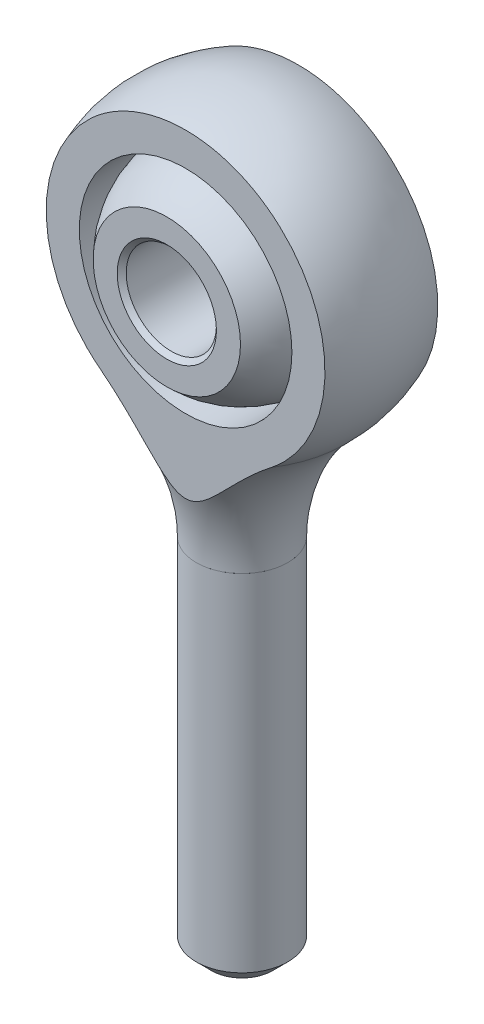
from build123d import *

# Parameters (mm, degrees)
SKETCH14_W               = 2.413
SKETCH14_H               = 19.05
CUT_EXTRUDE10_DEPTH      = 24.492854632
CUT_EXTRUDE10_DEPTH_BACK = 24.492854632
CUT_EXTRUDE9_DEPTH       = 23.310765057
CUT_EXTRUDE9_DEPTH_BACK  = 23.310765057
SKETCH17_R               = 5.6118125
CUT_EXTRUDE4_DEPTH       = 23.798733003
CUT_EXTRUDE4_DEPTH_BACK  = 23.798733003
SKETCH10_R               = 2.38125
CUT_EXTRUDE7_START       = -3.96875
SKETCH22_W               = 15.875
SKETCH22_H               = 20.6375
CUT_EXTRUDE7_DEPTH       = 19.829983003
CUT_EXTRUDE8_START       = 3.96875
SKETCH23_W               = 15.875
SKETCH23_H               = 20.6375
CUT_EXTRUDE8_DEPTH       = 19.829983003
CHAMFER1_SIZE            = 0.79502
CHAMFER2_SIZE            = 0.238125


with BuildPart() as part:
    # Sketch14 → Revolve4 (revolve)
    with BuildSketch(Plane.XY, mode=Mode.PRIVATE) as revolve4_sk:
        with Locations((1.2065, -9.525)):
            Rectangle(SKETCH14_W, SKETCH14_H)
    revolve(revolve4_sk.sketch.rotate(Axis((0, 0, 0), (0, -1, 0)), 180), axis=Axis((0, 0, 0), (0, -1, 0)))

    # Chamfer1
    chamfer1_edges = [part.edges().sort_by_distance(p)[0] for p in [
        (2.413, -19.05, 0),
    ]]
    chamfer(chamfer1_edges, length=CHAMFER1_SIZE)


with BuildPart() as body_2:
    # Sketch21 → Revolve5 (revolve)
    with BuildSketch(Plane.XY):
        with BuildLine():
            Line((0, 20.6375), (0, 0))
            Line((0, 0), (2.413, 0))
            ThreePointArc((2.413, 0), (3.195090321, 3.75855696), (5.41152983, 6.893172024))
            ThreePointArc((5.41152983, 6.893172024), (7.385648357, 15.607938203), (0, 20.6375))
        make_face()
    revolve(axis=Axis((0, 0, 0), (0, -1, 0)))

    # Sketch24 → Cut-Extrude10 (cut, two sides: drawn at the far end of the back side and taken through both)
    with BuildSketch(Plane(origin=(0, 0, 0), x_dir=(0, 0, -1), z_dir=(1, 0, 0)).offset(-CUT_EXTRUDE10_DEPTH_BACK)):
        Polygon((2.9765625, 12.7), (2.9765625, 20.6375), (7.9375, 20.6375), (7.9375, 0), (2.413, 0), (2.9765625, 0.5953125), align=None)
        Polygon((-2.413, 0), (-7.9375, 0), (-7.9375, 20.6375), (-2.9765625, 20.6375), (-2.9765625, 12.7), (-2.9765625, 0.5953125), align=None)
    extrude(amount=CUT_EXTRUDE10_DEPTH + CUT_EXTRUDE10_DEPTH_BACK, mode=Mode.SUBTRACT)

    # Sketch17 → Cut-Extrude9 (cut, two sides: drawn at the far end of the back side and taken through both)
    with BuildSketch(Plane.XY.offset(-CUT_EXTRUDE9_DEPTH_BACK)):
        with Locations((0, 12.7)):
            Circle(SKETCH17_R)
    extrude(amount=CUT_EXTRUDE9_DEPTH + CUT_EXTRUDE9_DEPTH_BACK, mode=Mode.SUBTRACT)


with BuildPart() as body_3:
    # Sketch7 → Revolve3 (revolve)
    with BuildSketch(Plane.XY):
        with BuildLine():
            Line((0, 18.25625), (0, 7.14375))
            ThreePointArc((0, 7.14375), (5.55625, 12.7), (0, 18.25625))
        make_face()
    revolve(axis=Axis((0, 0, 0), (0, 1, 0)))

    # Sketch10 → Cut-Extrude4 (cut, two sides: drawn at the far end of the back side and taken through both)
    with BuildSketch(Plane.XY.offset(-CUT_EXTRUDE4_DEPTH_BACK)):
        with Locations(Location((0, 12.7, 0), (0, 0, 180))):
            Circle(SKETCH10_R)
    extrude(amount=CUT_EXTRUDE4_DEPTH + CUT_EXTRUDE4_DEPTH_BACK, mode=Mode.SUBTRACT)

    # Sketch22 → Cut-Extrude7 (cut, through all)
    with BuildSketch(Plane.XY.offset(CUT_EXTRUDE7_START)):
        with Locations((0, 10.31875)):
            Rectangle(SKETCH22_W, SKETCH22_H)
    extrude(amount=-CUT_EXTRUDE7_DEPTH, mode=Mode.SUBTRACT)

    # Sketch23 → Cut-Extrude8 (cut, through all)
    with BuildSketch(Plane.XY.offset(CUT_EXTRUDE8_START)):
        with Locations((0, 10.31875)):
            Rectangle(SKETCH23_W, SKETCH23_H)
    extrude(amount=CUT_EXTRUDE8_DEPTH, mode=Mode.SUBTRACT)

    # Chamfer2
    chamfer2_edges = [body_3.edges().sort_by_distance(p)[0] for p in [
        (2.38125, 12.7, -3.96875),
        (2.38125, 12.7, 3.96875),
    ]]
    chamfer(chamfer2_edges, length=CHAMFER2_SIZE)


solid = Compound([part.part, body_2.part, body_3.part])
